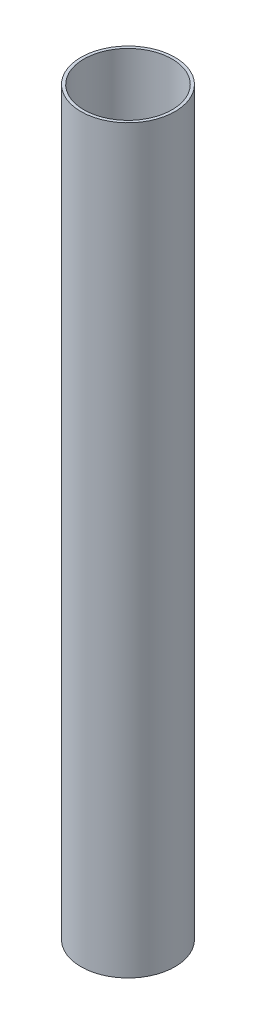
from build123d import *

# Parameters (mm, degrees)
SKETCH1_R           = 31.75
SKETCH1_R_2         = 29.75
BOSS_EXTRUDE1_DEPTH = 500


with BuildPart() as part:
    # Sketch1 → Boss-Extrude1 (new body)
    with BuildSketch(Plane(origin=(0, 0, 0), x_dir=(1, 0, 0), z_dir=(0, 1, 0))):
        with Locations(Location((0, 0, 0), (0, 0, 270))):
            Circle(SKETCH1_R)
        with Locations(Location((0, 0, 0), (0, 0, 270))):
            Circle(SKETCH1_R_2, mode=Mode.SUBTRACT)
    extrude(amount=BOSS_EXTRUDE1_DEPTH)


solid = part.part
